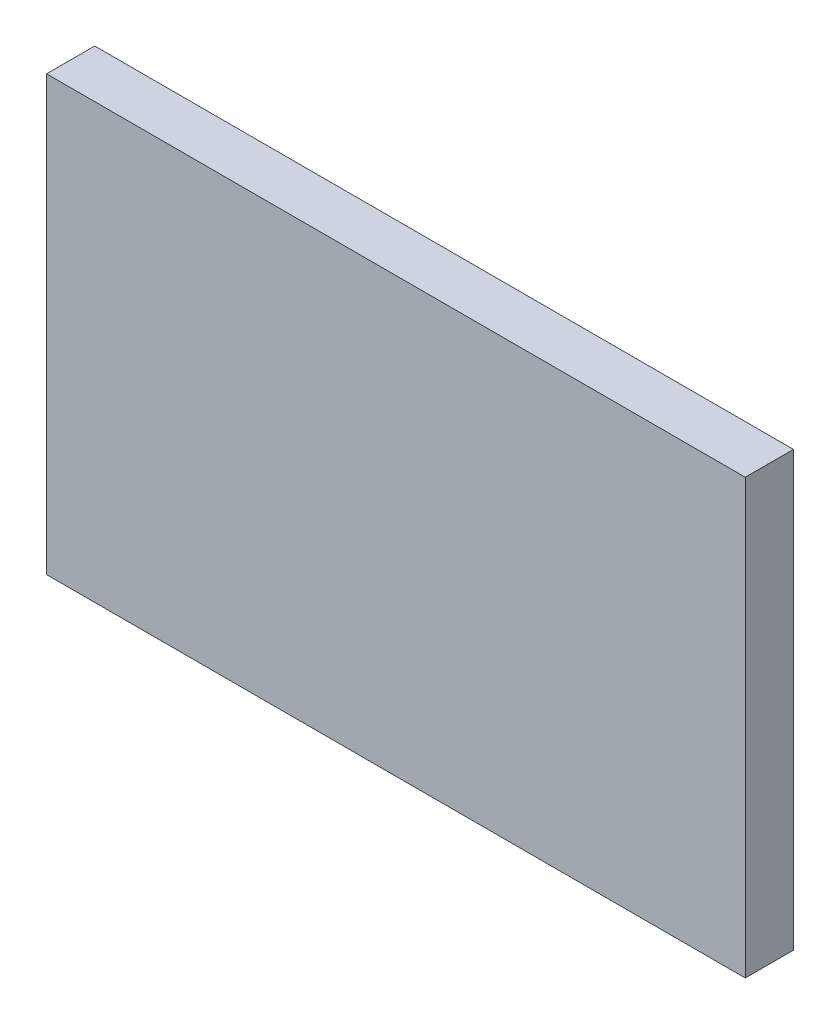
from build123d import *

# Parameters (mm, degrees)
SKETCH1_W           = 92.075
SKETCH1_H           = 57.15
BOSS_EXTRUDE1_DEPTH = 6.35


with BuildPart() as part:
    # Sketch1 → Boss-Extrude1 (new body)
    with BuildSketch(Plane.XY):
        Rectangle(SKETCH1_W, SKETCH1_H)
    extrude(amount=BOSS_EXTRUDE1_DEPTH)


solid = part.part
